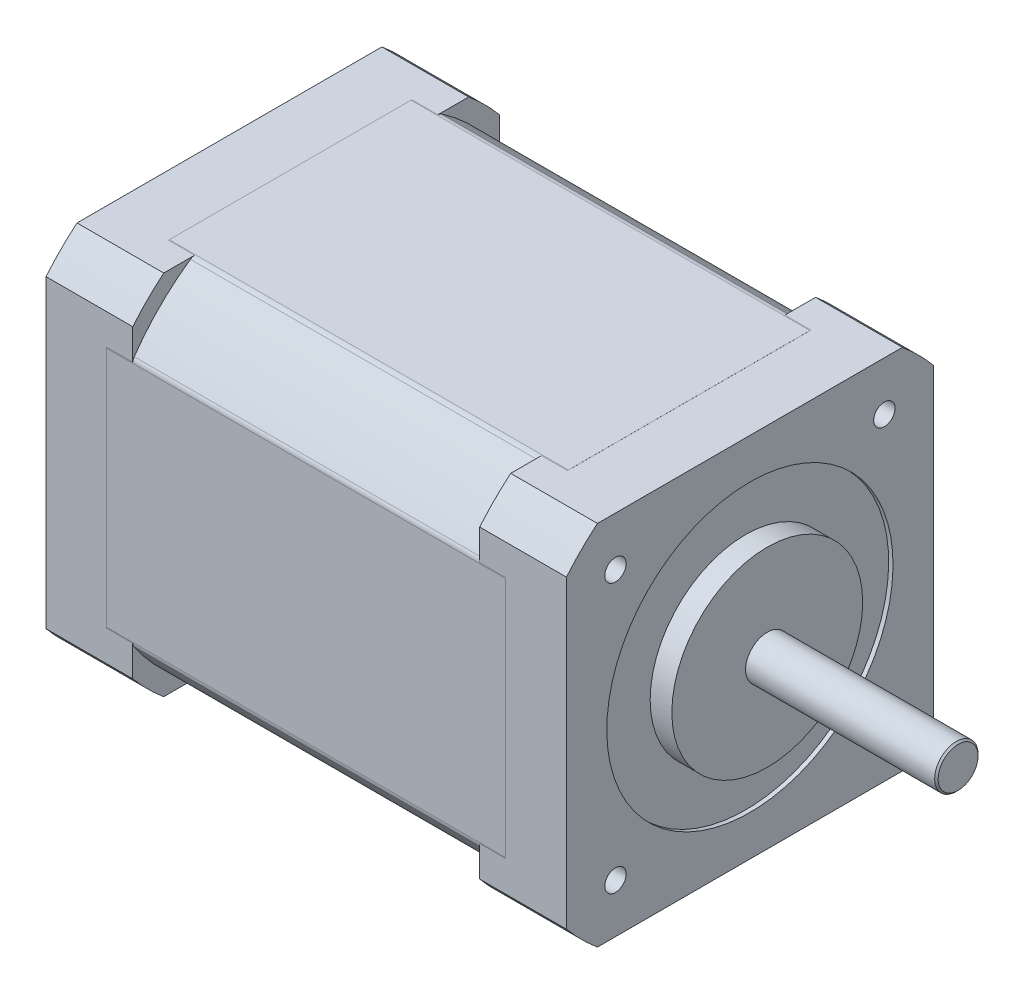
from build123d import *

# Parameters (mm, degrees)
BOSS_EXTRUDE1_DEPTH  = 60
SKETCH3_W            = 40
SKETCH3_H            = 42.3
CUT_EXTRUDE1_DEPTH   = 77.397725751
BOSS_EXTRUDE2_DEPTH  = 46
SKETCH5_R            = 3
CUT_EXTRUDE2_DEPTH   = 2
CUT_EXTRUDE3_DEPTH   = 1.5
LPATTERN1_COUNT      = 2
LPATTERN1_PITCH      = 32.2
LPATTERN1_COUNT_DIR2 = 2
LPATTERN1_PITCH_DIR2 = 32.2
TAP1_D               = 2.459
TAP1_DEPTH           = 4.5
TAP1_TIP             = 0.738758131
SKETCH10_W           = 0.5
SKETCH10_H           = 5.5
SKETCH11_W           = 4
SKETCH11_H           = 6.5
BOSS_EXTRUDE3_DEPTH  = 1.8


with BuildPart() as part:
    # Sketch1 → Boss-Extrude1 (new body)
    with BuildSketch(Plane(origin=(0, 0, 0), x_dir=(0, 0, -1), z_dir=(1, 0, 0))):
        with BuildLine():
            Line((-17.57633352, 21.15), (17.57633352, 21.15))
            ThreePointArc((17.57633352, 21.15), (19.445436483, 19.445436483), (21.15, 17.57633352))
            Line((21.15, 17.57633352), (21.15, -17.57633352))
            ThreePointArc((21.15, -17.57633352), (19.445436483, -19.445436483), (17.57633352, -21.15))
            Line((17.57633352, -21.15), (-17.57633352, -21.15))
            ThreePointArc((-17.57633352, -21.15), (-19.445436483, -19.445436483), (-21.15, -17.57633352))
            Line((-21.15, -17.57633352), (-21.15, 17.57633352))
            ThreePointArc((-21.15, 17.57633352), (-19.445436483, 19.445436483), (-17.57633352, 21.15))
        make_face()
    extrude(amount=-BOSS_EXTRUDE1_DEPTH)

    # Sketch2 → Revolve1 (revolve)
    with BuildSketch(Plane.XY, mode=Mode.PRIVATE) as revolve1_sk:
        Polygon((23.8, 2.5), (24, 2.3), (24, 0), (0, 0), (0, 11), (2, 11), (2, 2.5), align=None)
    revolve(revolve1_sk.sketch.rotate(Axis((-52.65, 0, 0), (1, 0, 0)), 90), axis=Axis((-52.65, 0, 0), (1, 0, 0)))

    # Sketch3 → Cut-Extrude1 (cut, through all)
    with BuildSketch(Plane(origin=(0, 21.15, 0), x_dir=(1, 0, 0), z_dir=(0, 1, 0))):
        with Locations((-30, 0)):
            Rectangle(SKETCH3_W, SKETCH3_H)
    extrude(amount=-CUT_EXTRUDE1_DEPTH, mode=Mode.SUBTRACT)


with BuildPart() as cut_extrude1_piece_1:
    # of the separate pieces the step leaves, piece 1, a body of its own (cut_extrude1_pieces)
    add(part.part.solids().sort_by_distance((0, 21.15, 17.57633352))[0])



with BuildPart() as cut_extrude1_piece_2:
    # of the separate pieces the step leaves, piece 2, a body of its own (cut_extrude1_pieces)
    add(part.part.solids().sort_by_distance((-50, 21.15, 17.57633352))[0])


with BuildPart() as cut_extrude1_piece_1_1:
    add(cut_extrude1_piece_1.part)

    add(cut_extrude1_piece_2.part)  # Boss-Extrude2 merges Cut-Extrude1 piece 2
    # Sketch4 → Boss-Extrude2 (add)
    with BuildSketch(Plane(origin=(-7, 0, 0), x_dir=(0, 0, -1), z_dir=(1, 0, 0))):
        with BuildLine():
            Line((13.929320694, -21.155), (-13.929320694, -21.155))
            ThreePointArc((-13.929320694, -21.155), (-14.227101602, -21.109634239), (-14.497864396, -20.977653061))
            ThreePointArc((-14.497864396, -20.977653061), (-18.03122292, -18.03122292), (-20.977653061, -14.497864396))
            ThreePointArc((-20.977653061, -14.497864396), (-21.109634239, -14.227101602), (-21.155, -13.929320694))
            Line((-21.155, -13.929320694), (-21.155, 13.929320694))
            ThreePointArc((-21.155, 13.929320694), (-21.109634239, 14.227101602), (-20.977653061, 14.497864396))
            ThreePointArc((-20.977653061, 14.497864396), (-18.03122292, 18.03122292), (-14.497864396, 20.977653061))
            ThreePointArc((-14.497864396, 20.977653061), (-14.227101602, 21.109634239), (-13.929320694, 21.155))
            Line((-13.929320694, 21.155), (13.929320694, 21.155))
            ThreePointArc((13.929320694, 21.155), (14.227101602, 21.109634239), (14.497864396, 20.977653061))
            ThreePointArc((14.497864396, 20.977653061), (18.03122292, 18.03122292), (20.977653061, 14.497864396))
            ThreePointArc((20.977653061, 14.497864396), (21.109634239, 14.227101602), (21.155, 13.929320694))
            Line((21.155, 13.929320694), (21.155, -13.929320694))
            ThreePointArc((21.155, -13.929320694), (21.109634239, -14.227101602), (20.977653061, -14.497864396))
            ThreePointArc((20.977653061, -14.497864396), (18.03122292, -18.03122292), (14.497864396, -20.977653061))
            ThreePointArc((14.497864396, -20.977653061), (14.227101602, -21.109634239), (13.929320694, -21.155))
        make_face()
    extrude(amount=-BOSS_EXTRUDE2_DEPTH)

    # Sketch5 → Cut-Extrude2 (cut)
    with BuildSketch(Plane.ZY.offset(60)):
        with Locations((-16.15, 16.15)):
            Circle(SKETCH5_R)
        with Locations(Location((16.15, 16.15, 0), (0, 0, 180))):
            Circle(SKETCH5_R)
        with Locations((16.15, -16.15)):
            Circle(SKETCH5_R)
        with Locations(Location((-16.15, -16.15, 0), (0, 0, 180))):
            Circle(SKETCH5_R)
    extrude(amount=-CUT_EXTRUDE2_DEPTH, mode=Mode.SUBTRACT)

    # Sketch6 → Revolve2 (revolve)
    with BuildSketch(Plane(origin=(0, 0, -16.15), x_dir=(-1, 0, 0), z_dir=(0, 0, -1)), mode=Mode.PRIVATE) as revolve2_sk:
        with BuildLine():
            Line((58, 16.15), (60, 16.15))
            Line((60, 16.15), (60, 14.6))
            ThreePointArc((60, 14.6), (59.648528137, 13.751471863), (58.8, 13.4))
            Line((58.8, 13.4), (58, 13.4))
            Line((58, 13.4), (58, 16.15))
        make_face()
    revolve2 = revolve(revolve2_sk.sketch.rotate(Axis((-58, 16.15, -16.15), (-1, 0, 0)), 270), axis=Axis((-58, 16.15, -16.15), (-1, 0, 0)))

    # Sketch7 → Cut-Extrude3 (cut)
    with BuildSketch(Plane.ZY.offset(60)):
        with BuildLine():
            Line((-15.7, 16.4), (-14.4, 16.4))
            Line((-14.4, 16.4), (-14.4, 15.9))
            Line((-14.4, 15.9), (-15.7, 15.9))
            ThreePointArc((-15.7, 15.9), (-15.841421356, 15.841421356), (-15.9, 15.7))
            Line((-15.9, 15.7), (-15.9, 14.4))
            Line((-15.9, 14.4), (-16.4, 14.4))
            Line((-16.4, 14.4), (-16.4, 15.7))
            ThreePointArc((-16.4, 15.7), (-16.458578644, 15.841421356), (-16.6, 15.9))
            Line((-16.6, 15.9), (-17.9, 15.9))
            Line((-17.9, 15.9), (-17.9, 16.4))
            Line((-17.9, 16.4), (-16.6, 16.4))
            ThreePointArc((-16.6, 16.4), (-16.458578644, 16.458578644), (-16.4, 16.6))
            Line((-16.4, 16.6), (-16.4, 17.9))
            Line((-16.4, 17.9), (-15.9, 17.9))
            Line((-15.9, 17.9), (-15.9, 16.6))
            ThreePointArc((-15.9, 16.6), (-15.841421356, 16.458578644), (-15.7, 16.4))
        make_face()
    cut_extrude3 = extrude(amount=-CUT_EXTRUDE3_DEPTH, mode=Mode.SUBTRACT)

    # LPattern1: Revolve2, Cut-Extrude3 2 × 2
    with Locations(*[(0, -i * LPATTERN1_PITCH, j * LPATTERN1_PITCH_DIR2) for i in range(LPATTERN1_COUNT) for j in range(LPATTERN1_COUNT_DIR2) if (i, j) != (0, 0)]):
        add(revolve2)
        add(cut_extrude3, mode=Mode.SUBTRACT)

    # Tap1
    with Locations(Plane(origin=(0, 0, 0), x_dir=(0, 0, -1), z_dir=(1, 0, 0))):
        with Locations((-15.5, 15.5), (15.5, 15.5), (15.5, -15.5), (-15.5, -15.5)):
            Hole(TAP1_D / 2, depth=TAP1_DEPTH)
            with Locations((0, 0, -(TAP1_DEPTH + TAP1_TIP / 2))):  # 118° drill point
                Cone(0, TAP1_D / 2, TAP1_TIP, mode=Mode.SUBTRACT)

    # Sketch10 → Cut-Revolve1 (revolve, cut)
    with BuildSketch(Plane.XY):
        with Locations((-0.25, 13.75)):
            Rectangle(SKETCH10_W, SKETCH10_H)
    revolve(axis=Axis((0, 0, 0), (-1, 0, 0)), mode=Mode.SUBTRACT)

    # Sketch11 → Boss-Extrude3 (add)
    with BuildSketch(Plane.XZ.offset(21.15)):
        with Locations((-56, 0)):
            Rectangle(SKETCH11_W, SKETCH11_H)
    extrude(amount=BOSS_EXTRUDE3_DEPTH)


solid = cut_extrude1_piece_1_1.part
